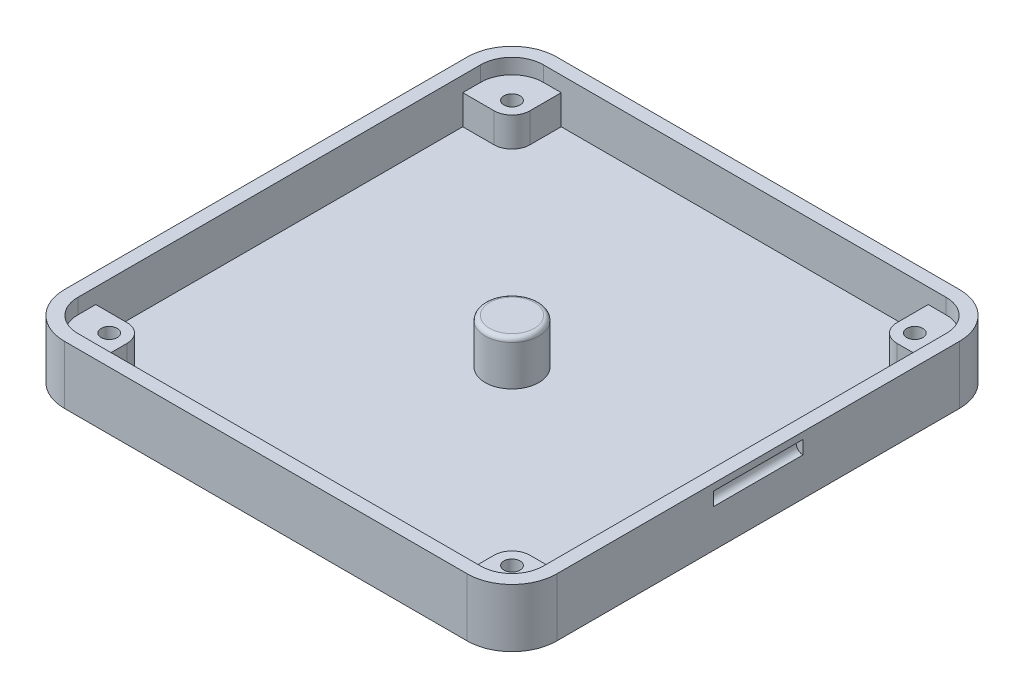
from build123d import *

# Parameters (mm, degrees)
BOSS_EXTRUDE1_DEPTH = 1.5
BOSS_EXTRUDE2_DEPTH = 5
SKETCH5_R           = 3
BOSS_EXTRUDE3_DEPTH = 5
SKETCH6_R           = 0.9
BOSS_EXTRUDE4_DEPTH = 3.3
FILLET1_R           = 0.5
SKETCH7_R           = 1.75
CUT_EXTRUDE1_DEPTH  = 2
SKETCH9_R           = 0.75
CUT_EXTRUDE2_DEPTH  = 5


with BuildPart() as part:
    # Sketch1 → Boss-Extrude1 (new body)
    with BuildSketch(Plane(origin=(0, 0, 0), x_dir=(1, 0, 0), z_dir=(0, 1, 0))):
        with BuildLine():
            Line((-22.5, -27.5), (22.5, -27.5))
            ThreePointArc((22.5, -27.5), (26.035533906, -26.035533906), (27.5, -22.5))
            Line((27.5, -22.5), (27.5, 22.5))
            ThreePointArc((27.5, 22.5), (26.035533906, 26.035533906), (22.5, 27.5))
            Line((22.5, 27.5), (-22.5, 27.5))
            ThreePointArc((-22.5, 27.5), (-26.035533906, 26.035533906), (-27.5, 22.5))
            Line((-27.5, 22.5), (-27.5, -22.5))
            ThreePointArc((-27.5, -22.5), (-26.035533906, -26.035533906), (-22.5, -27.5))
        make_face()
    extrude(amount=BOSS_EXTRUDE1_DEPTH)

    # Sketch2 → Boss-Extrude2 (add)
    with BuildSketch(Plane(origin=(0, 1.5, 0), x_dir=(1, 0, 0), z_dir=(0, 1, 0))):
        with BuildLine():
            Line((-27.5, 22.5), (-27.5, -22.5))
            ThreePointArc((-27.5, -22.5), (-26.035533906, -26.035533906), (-22.5, -27.5))
            Line((-22.5, -27.5), (22.5, -27.5))
            ThreePointArc((22.5, -27.5), (26.035533906, -26.035533906), (27.5, -22.5))
            Line((27.5, -22.5), (27.5, 22.5))
            ThreePointArc((27.5, 22.5), (26.035533906, 26.035533906), (22.5, 27.5))
            Line((22.5, 27.5), (-22.5, 27.5))
            ThreePointArc((-22.5, 27.5), (-26.035533906, 26.035533906), (-27.5, 22.5))
        make_face()
        with BuildLine():
            Line((-26, 22.5), (-26, -22.5))
            ThreePointArc((-26, -22.5), (-24.974873734, -24.974873734), (-22.5, -26))
            Line((-22.5, -26), (22.5, -26))
            ThreePointArc((22.5, -26), (24.974873734, -24.974873734), (26, -22.5))
            Line((26, -22.5), (26, 22.5))
            ThreePointArc((26, 22.5), (24.974873734, 24.974873734), (22.5, 26))
            Line((22.5, 26), (-22.5, 26))
            ThreePointArc((-22.5, 26), (-24.974873734, 24.974873734), (-26, 22.5))
        make_face(mode=Mode.SUBTRACT)
    extrude(amount=BOSS_EXTRUDE2_DEPTH)

    # Sketch5 → Boss-Extrude3 (add)
    with BuildSketch(Plane(origin=(0, 1.5, 0), x_dir=(1, 0, 0), z_dir=(0, 1, 0))):
        with Locations(Location((0, 0, 0), (0, 0, 90))):
            Circle(SKETCH5_R)
    extrude(amount=BOSS_EXTRUDE3_DEPTH)

    # Sketch6 → Boss-Extrude4 (add)
    # profile 1 of 4: a face of its own
    with BuildSketch(Plane(origin=(0, 1.5, 0), x_dir=(1, 0, 0), z_dir=(0, 1, 0))):
        with BuildLine():
            Line((-20.5, 26), (-20.5, 22.5))
            ThreePointArc((-20.5, 22.5), (-21.085786438, 21.085786438), (-22.5, 20.5))
            Line((-22.5, 20.5), (-26, 20.5))
            Line((-26, 20.5), (-26, 22.5))
            ThreePointArc((-26, 22.5), (-24.974873734, 24.974873734), (-22.5, 26))
            Line((-22.5, 26), (-20.5, 26))
        make_face()
        with Locations(Location((-22.5, 22.5, 0), (0, 0, 270))):
            Circle(SKETCH6_R, mode=Mode.SUBTRACT)
    # profile 2 of 4: a face of its own
    with BuildSketch(Plane(origin=(0, 1.5, 0), x_dir=(1, 0, 0), z_dir=(0, 1, 0))):
        with BuildLine():
            Line((22.5, 26), (20.5, 26))
            Line((20.5, 26), (20.5, 22.5))
            ThreePointArc((20.5, 22.5), (21.085786438, 21.085786438), (22.5, 20.5))
            Line((22.5, 20.5), (26, 20.5))
            Line((26, 20.5), (26, 22.5))
            ThreePointArc((26, 22.5), (24.974873734, 24.974873734), (22.5, 26))
        make_face()
        with Locations(Location((22.5, 22.5, 0), (0, 0, 90))):
            Circle(SKETCH6_R, mode=Mode.SUBTRACT)
    # profile 3 of 4: a face of its own
    with BuildSketch(Plane(origin=(0, 1.5, 0), x_dir=(1, 0, 0), z_dir=(0, 1, 0))):
        with BuildLine():
            Line((20.5, -26), (20.5, -22.5))
            ThreePointArc((20.5, -22.5), (21.085786438, -21.085786438), (22.5, -20.5))
            Line((22.5, -20.5), (26, -20.5))
            Line((26, -20.5), (26, -22.5))
            ThreePointArc((26, -22.5), (24.974873734, -24.974873734), (22.5, -26))
            Line((22.5, -26), (20.5, -26))
        make_face()
        with Locations(Location((22.5, -22.5, 0), (0, 0, 270))):
            Circle(SKETCH6_R, mode=Mode.SUBTRACT)
    # profile 4 of 4: a face of its own
    with BuildSketch(Plane(origin=(0, 1.5, 0), x_dir=(1, 0, 0), z_dir=(0, 1, 0))):
        with BuildLine():
            Line((-22.5, -26), (-20.5, -26))
            Line((-20.5, -26), (-20.5, -22.5))
            ThreePointArc((-20.5, -22.5), (-21.085786438, -21.085786438), (-22.5, -20.5))
            Line((-22.5, -20.5), (-26, -20.5))
            Line((-26, -20.5), (-26, -22.5))
            ThreePointArc((-26, -22.5), (-24.974873734, -24.974873734), (-22.5, -26))
        make_face()
        with Locations(Location((-22.5, -22.5, 0), (0, 0, 90))):
            Circle(SKETCH6_R, mode=Mode.SUBTRACT)
    extrude(amount=BOSS_EXTRUDE4_DEPTH)

    # Fillet1
    fillet1_edges = [part.edges().sort_by_distance(p)[0] for p in [
        (0, 6.5, 3),
    ]]
    fillet(fillet1_edges, radius=FILLET1_R)

    # Sketch7 → Cut-Extrude1 (cut)
    with BuildSketch(Plane.XZ):
        with Locations(Location((-22.5, 22.5, 0), (0, 0, 270))):
            Circle(SKETCH7_R)
        with Locations(Location((22.5, 22.5, 0), (0, 0, 90))):
            Circle(SKETCH7_R)
        with Locations(Location((22.5, -22.5, 0), (0, 0, 270))):
            Circle(SKETCH7_R)
        with Locations(Location((-22.5, -22.5, 0), (0, 0, 90))):
            Circle(SKETCH7_R)
    extrude(amount=-CUT_EXTRUDE1_DEPTH, mode=Mode.SUBTRACT)

    # Sketch9 → Cut-Extrude2 (cut, symmetric)
    with BuildSketch(Plane.XY):
        with Locations((-27.5, 5)):
            Circle(SKETCH9_R)
        with Locations((27.5, 5)):
            Circle(SKETCH9_R)
    extrude(amount=CUT_EXTRUDE2_DEPTH, both=True, mode=Mode.SUBTRACT)


solid = part.part
